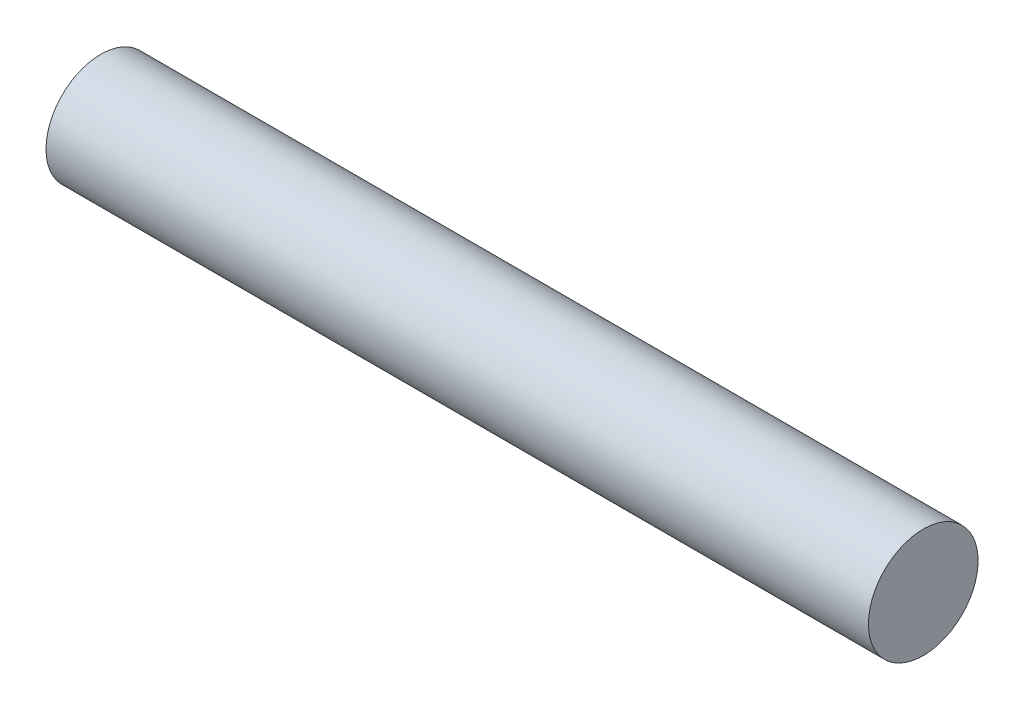
from build123d import *

# Parameters (mm, degrees)
SKETCH_191_W = 120
SKETCH_191_H = 8


with BuildPart() as part:
    # Sketch 191 → Revolve 213 (revolve)
    with BuildSketch(Plane.XY, mode=Mode.PRIVATE) as revolve_213_sk:
        with Locations((60, 4)):
            Rectangle(SKETCH_191_W, SKETCH_191_H)
    revolve(revolve_213_sk.sketch.rotate(Axis((-0.5, 0, 0), (1, 0, 0)), 90), axis=Axis((-0.5, 0, 0), (1, 0, 0)))


solid = part.part
